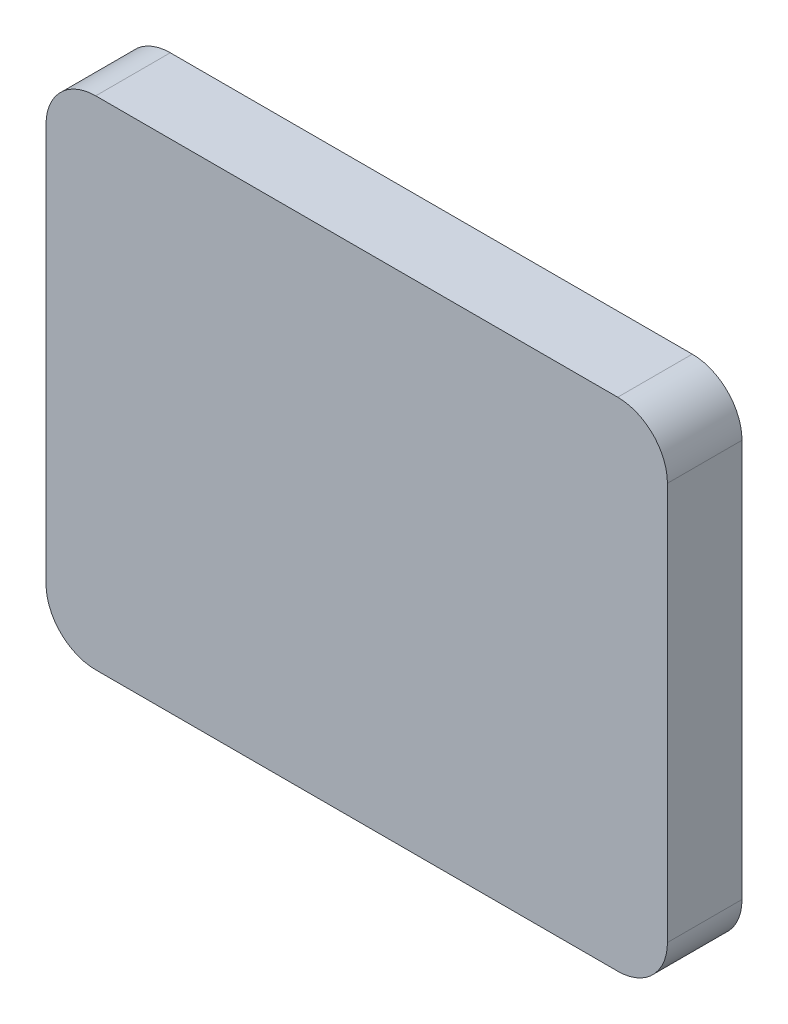
from build123d import *

# Parameters (mm, degrees)
ESBO_O1_W                = 25
ESBO_O1_H                = 20
RESSALTO_EXTRUS_O1_DEPTH = 3
FILETE1_R                = 2


with BuildPart() as part:
    # Esboço1 → Ressalto-extrusão1 (new body)
    with BuildSketch(Plane.XY):
        Rectangle(ESBO_O1_W, ESBO_O1_H)
    extrude(amount=RESSALTO_EXTRUS_O1_DEPTH)

    # Filete1
    filete1_edges = [part.edges().sort_by_distance(p)[0] for p in [
        (-12.5, 10, 1.5),
        (12.5, 10, 1.5),
        (12.5, -10, 1.5),
        (-12.5, -10, 1.5),
    ]]
    fillet(filete1_edges, radius=FILETE1_R)


solid = part.part
